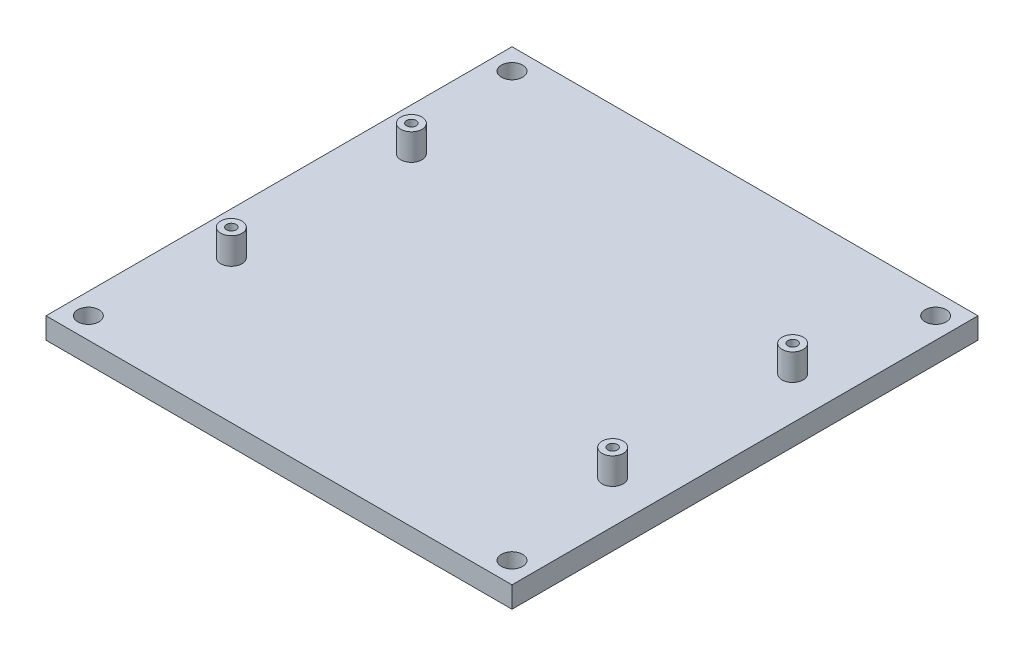
from build123d import *

# Parameters (mm, degrees)
SKETCH1_W           = 139.7
SKETCH1_H           = 139.7
BOSS_EXTRUDE1_DEPTH = 6.35
SKETCH2_R           = 3.175
CUT_EXTRUDE1_DEPTH  = 6.35
SKETCH4_R           = 3.175
SKETCH4_R_2         = 1.42875
BOSS_EXTRUDE2_DEPTH = 7.9375


with BuildPart() as part:
    # Sketch1 → Boss-Extrude1 (new body)
    with BuildSketch(Plane(origin=(0, 0, 0), x_dir=(1, 0, 0), z_dir=(0, 1, 0))):
        Rectangle(SKETCH1_W, SKETCH1_H)
    extrude(amount=BOSS_EXTRUDE1_DEPTH)

    # Sketch2 → Cut-Extrude1 (cut)
    with BuildSketch(Plane(origin=(0, 6.35, 0), x_dir=(1, 0, 0), z_dir=(0, 1, 0))):
        with Locations(Location((-63.5, -63.5, 0), (0, 0, 270))):
            Circle(SKETCH2_R)
        with Locations(Location((63.5, -63.5, 0), (0, 0, 90))):
            Circle(SKETCH2_R)
        with Locations(Location((63.5, 63.5, 0), (0, 0, 270))):
            Circle(SKETCH2_R)
        with Locations(Location((-63.5, 63.5, 0), (0, 0, 90))):
            Circle(SKETCH2_R)
    extrude(amount=-CUT_EXTRUDE1_DEPTH, mode=Mode.SUBTRACT)

    # Sketch4 → Boss-Extrude2 (add)
    # profile 1 of 4: a face of its own
    with BuildSketch(Plane(origin=(0, 6.35, 0), x_dir=(1, 0, 0), z_dir=(0, 1, 0))):
        with Locations(Location((-57.15, 26.9875, 0), (0, 0, 270))):
            Circle(SKETCH4_R)
        with Locations(Location((-57.15, 26.9875, 0), (0, 0, 270))):
            Circle(SKETCH4_R_2, mode=Mode.SUBTRACT)
    # profile 2 of 4: a face of its own
    with BuildSketch(Plane(origin=(0, 6.35, 0), x_dir=(1, 0, 0), z_dir=(0, 1, 0))):
        with Locations(Location((-57.15, -26.9875, 0), (0, 0, 270))):
            Circle(SKETCH4_R)
        with Locations(Location((-57.15, -26.9875, 0), (0, 0, 270))):
            Circle(SKETCH4_R_2, mode=Mode.SUBTRACT)
    # profile 3 of 4: a face of its own
    with BuildSketch(Plane(origin=(0, 6.35, 0), x_dir=(1, 0, 0), z_dir=(0, 1, 0))):
        with Locations(Location((57.15, -26.9875, 0), (0, 0, 270))):
            Circle(SKETCH4_R)
        with Locations(Location((57.15, -26.9875, 0), (0, 0, 270))):
            Circle(SKETCH4_R_2, mode=Mode.SUBTRACT)
    # profile 4 of 4: a face of its own
    with BuildSketch(Plane(origin=(0, 6.35, 0), x_dir=(1, 0, 0), z_dir=(0, 1, 0))):
        with Locations(Location((57.15, 26.9875, 0), (0, 0, 270))):
            Circle(SKETCH4_R)
        with Locations(Location((57.15, 26.9875, 0), (0, 0, 270))):
            Circle(SKETCH4_R_2, mode=Mode.SUBTRACT)
    extrude(amount=BOSS_EXTRUDE2_DEPTH)


solid = part.part
